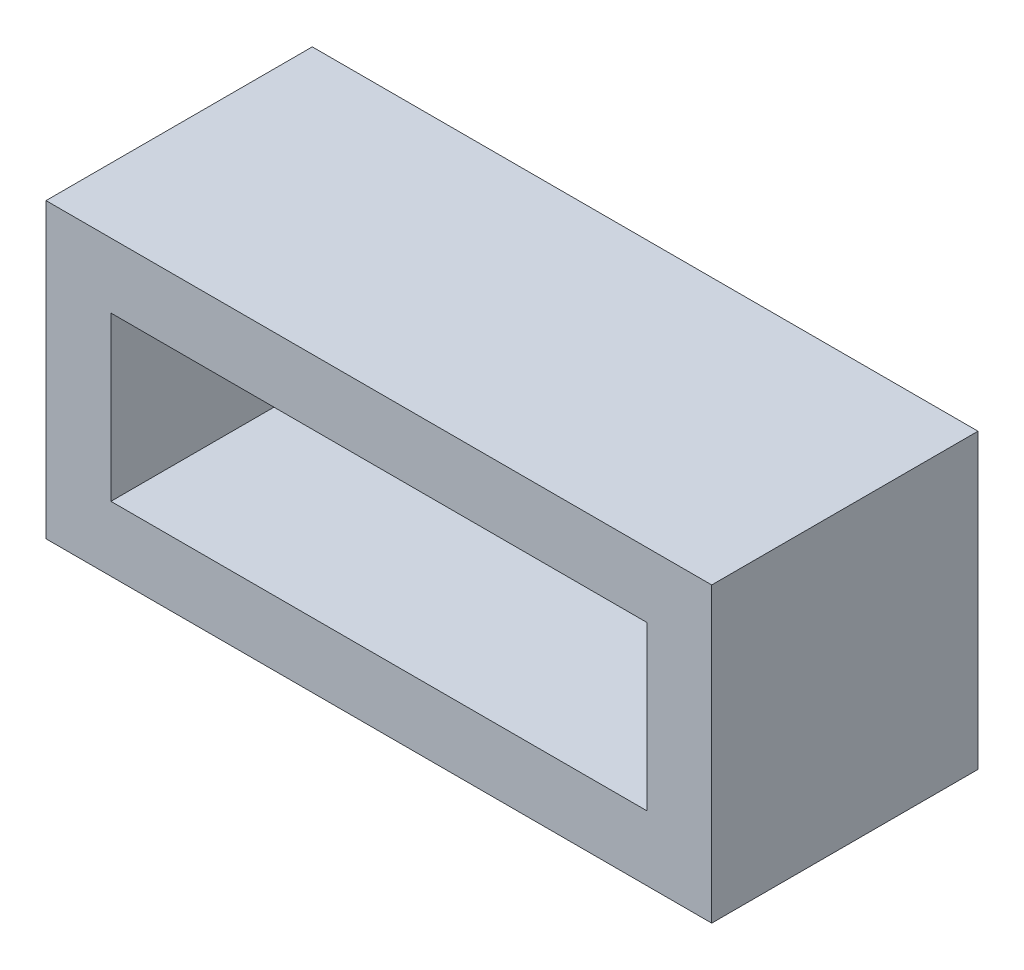
from build123d import *

# Parameters (mm, degrees)
SKETCH1_W           = 25
SKETCH1_H           = 11
SKETCH1_W_2         = 20.125
SKETCH1_H_2         = 6.125
BOSS_EXTRUDE1_DEPTH = 10


with BuildPart() as part:
    # Sketch1 → Boss-Extrude1 (new body)
    with BuildSketch(Plane.XY):
        Rectangle(SKETCH1_W, SKETCH1_H)
        Rectangle(SKETCH1_W_2, SKETCH1_H_2, mode=Mode.SUBTRACT)
    extrude(amount=BOSS_EXTRUDE1_DEPTH)


solid = part.part
